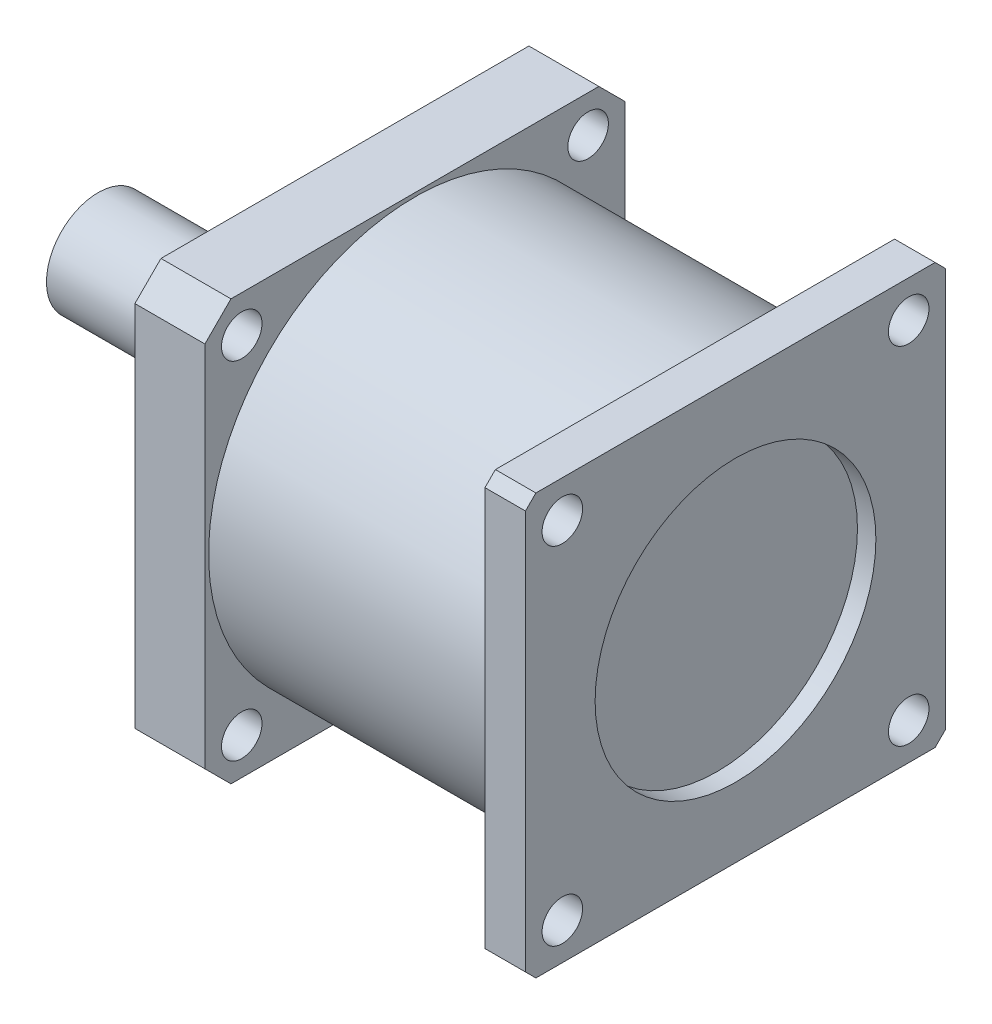
from build123d import *

# Parameters (mm, degrees)
SKETCH1_R           = 28
BOSS_EXTRUDE1_DEPTH = 38
BOSS_EXTRUDE2_DEPTH = 5.5
SKETCH4_R           = 19.05
CUT_EXTRUDE1_DEPTH  = 2.5
CUT_EXTRUDE2_DEPTH  = 5.5
CIRPATTERN1_COUNT   = 4
BOSS_EXTRUDE3_DEPTH = 9.5
CUT_EXTRUDE3_DEPTH  = 9.5
CIRPATTERN2_COUNT   = 4
SKETCH8_R           = 20
BOSS_EXTRUDE4_DEPTH = 2.5
SKETCH9_R           = 7.5
BOSS_EXTRUDE5_DEPTH = 1
SKETCH10_R          = 7
BOSS_EXTRUDE6_DEPTH = 30
SKETCH11_R          = 2
CUT_EXTRUDE4_DEPTH  = 10
CUT_EXTRUDE5_DEPTH  = 60
CIRPATTERN3_COUNT   = 4


with BuildPart() as part:
    # Sketch1 → Boss-Extrude1 (new body)
    with BuildSketch(Plane(origin=(0, 0, 0), x_dir=(0, 0, -1), z_dir=(1, 0, 0))):
        Circle(SKETCH1_R)
    extrude(amount=BOSS_EXTRUDE1_DEPTH)

    # Sketch2 → Boss-Extrude2 (add)
    with BuildSketch(Plane(origin=(38, 0, 0), x_dir=(0, 0, -1), z_dir=(1, 0, 0))):
        Polygon((28.5, 0), (28.5, 28.5), (-28.5, 28.5), (-28.5, -28.5), (28.5, -28.5), align=None)
    extrude(amount=BOSS_EXTRUDE2_DEPTH)

    # Sketch4 → Cut-Extrude1 (cut)
    with BuildSketch(Plane(origin=(43.5, 0, 0), x_dir=(0, 0, -1), z_dir=(1, 0, 0))):
        Circle(SKETCH4_R)
    extrude(amount=-CUT_EXTRUDE1_DEPTH, mode=Mode.SUBTRACT)

    # Sketch5 → Cut-Extrude2 (cut)
    with BuildSketch(Plane(origin=(43.5, 0, 0), x_dir=(0, 0, -1), z_dir=(1, 0, 0))):
        Polygon((-27.085786438, 28.5), (-28.5, 27.085786438), (-28.5, 28.5), align=None)
    cut_extrude2 = extrude(amount=-CUT_EXTRUDE2_DEPTH, mode=Mode.SUBTRACT)

    # CirPattern1: Cut-Extrude2 ×4 about axis
    cirpattern1_axis = Axis((0, 0, 0), (1, 0, 0))
    for i in range(1, CIRPATTERN1_COUNT):
        add(cut_extrude2.rotate(cirpattern1_axis, i * 360 / CIRPATTERN1_COUNT), mode=Mode.SUBTRACT)

    # Sketch6 → Boss-Extrude3 (add)
    with BuildSketch(Plane.ZY):
        Polygon((28.5, 0), (28.5, -28.5), (-28.5, -28.5), (-28.5, 28.5), (28.5, 28.5), align=None)
    extrude(amount=BOSS_EXTRUDE3_DEPTH)

    # Sketch7 → Cut-Extrude3 (cut)
    with BuildSketch(Plane.ZY.offset(9.5)):
        Polygon((-24.964466094, 28.5), (-28.5, 24.964466094), (-28.5, 28.5), align=None)
    cut_extrude3 = extrude(amount=-CUT_EXTRUDE3_DEPTH, mode=Mode.SUBTRACT)

    # CirPattern2: Cut-Extrude3 ×4 about axis
    cirpattern2_axis = Axis((0, 0, 0), (1, 0, 0))
    for i in range(1, CIRPATTERN2_COUNT):
        add(cut_extrude3.rotate(cirpattern2_axis, i * 360 / CIRPATTERN2_COUNT), mode=Mode.SUBTRACT)

    # Sketch8 → Boss-Extrude4 (add)
    with BuildSketch(Plane.ZY.offset(9.5)):
        Circle(SKETCH8_R)
    extrude(amount=BOSS_EXTRUDE4_DEPTH)

    # Sketch9 → Boss-Extrude5 (add)
    with BuildSketch(Plane.ZY.offset(12)):
        Circle(SKETCH9_R)
    extrude(amount=BOSS_EXTRUDE5_DEPTH)

    # Sketch10 → Boss-Extrude6 (add)
    with BuildSketch(Plane.ZY.offset(13)):
        Circle(SKETCH10_R)
    extrude(amount=BOSS_EXTRUDE6_DEPTH)

    # Sketch11 → Cut-Extrude4 (cut)
    with BuildSketch(Plane.ZY.offset(43)):
        Circle(SKETCH11_R)
    extrude(amount=-CUT_EXTRUDE4_DEPTH, mode=Mode.SUBTRACT)

    # Sketch12 → Cut-Extrude5 (cut)
    with BuildSketch(Plane(origin=(43.5, 0, 0), x_dir=(0, 0, -1), z_dir=(1, 0, 0))):
        with BuildLine():
            ThreePointArc((-23.5, 20.75), (-21.555456352, 21.555456352), (-20.75, 23.5))
            Line((-20.75, 23.5), (-23.5, 23.5))
            Line((-23.5, 23.5), (-23.5, 20.75))
        make_face()
        with BuildLine():
            Line((-23.5, 23.5), (-20.75, 23.5))
            ThreePointArc((-20.75, 23.5), (-25.444543648, 25.444543648), (-23.5, 20.75))
            Line((-23.5, 20.75), (-23.5, 23.5))
        make_face()
    cut_extrude5 = extrude(amount=-CUT_EXTRUDE5_DEPTH, mode=Mode.SUBTRACT)

    # CirPattern3: Cut-Extrude5 ×4 about axis
    cirpattern3_axis = Axis((0, 0, 0), (1, 0, 0))
    for i in range(1, CIRPATTERN3_COUNT):
        add(cut_extrude5.rotate(cirpattern3_axis, i * 360 / CIRPATTERN3_COUNT), mode=Mode.SUBTRACT)


solid = part.part
